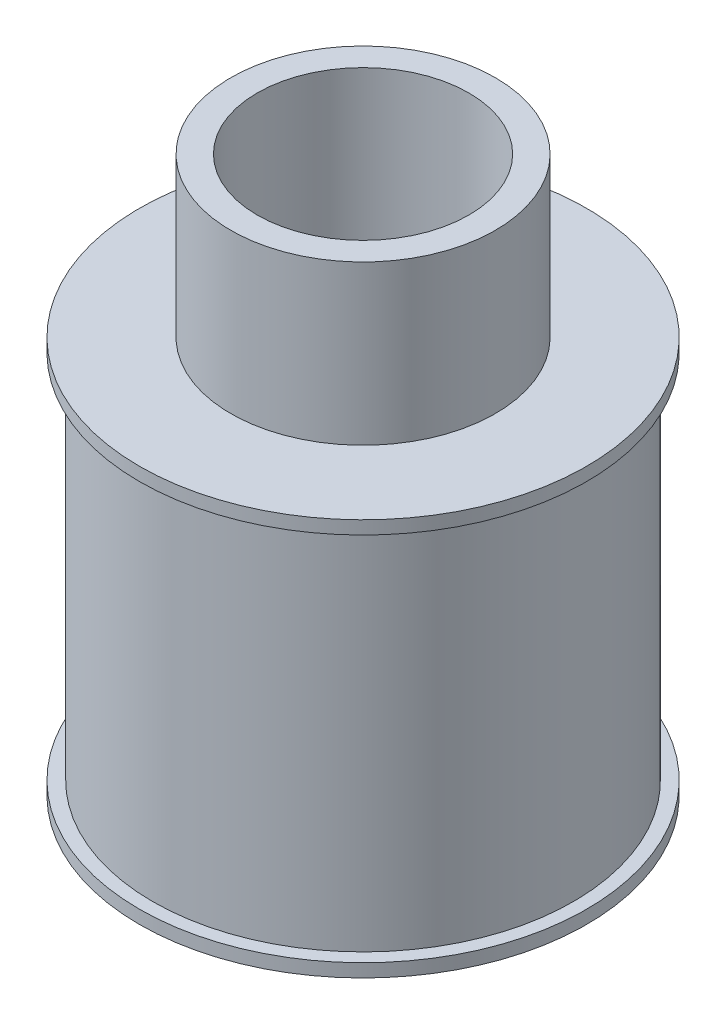
from build123d import *

# Parameters (mm, degrees)
CROQUIS1_R                 = 7.95
SALIENTE_EXTRUIR1_DEPTH    = 7.5
CROQUIS2_R                 = 8.45
SALIENTE_EXTRUIR2_DEPTH    = 0.5
SALIENTE_EXTRUIR3_START    = -14.5
CROQUIS2_2_R               = 8.45
SALIENTE_EXTRUIR3_DEPTH    = 0.5
CROQUIS3_R                 = 5
SALIENTE_EXTRUIR4_DEPTH    = 21
CORTAR_EXTRUIR1_DEPTH      = 24.728779994
CORTAR_EXTRUIR1_DEPTH_BACK = 24.728779994
CROQUIS4_R                 = 3
CROQUIS10_R                = 4
CORTAR_EXTRUIR2_DEPTH      = 25.162057032


with BuildPart() as part:
    # Croquis1 → Saliente-Extruir1 (new, symmetric)
    with BuildSketch(Plane(origin=(0, 0, 0), x_dir=(-1, 0, 0), z_dir=(0, 1, 0))):
        with Locations(Location((0, 0, 0), (0, 0, 90))):
            Circle(CROQUIS1_R)
    extrude(amount=SALIENTE_EXTRUIR1_DEPTH, both=True)

    # Croquis2 → Saliente-Extruir2 (add)
    with BuildSketch(Plane(origin=(0, 7.5, 0), x_dir=(-1, 0, 0), z_dir=(0, 1, 0))):
        with Locations(Location((0, 0, 0), (0, 0, 90))):
            Circle(CROQUIS2_R)
    extrude(amount=-SALIENTE_EXTRUIR2_DEPTH)

    # Croquis2<2> → Saliente-Extruir3 (add)
    with BuildSketch(Plane(origin=(0, 7.5, 0), x_dir=(-1, 0, 0), z_dir=(0, 1, 0)).offset(SALIENTE_EXTRUIR3_START)):
        with Locations(Location((0, 0, 0), (0, 0, 90))):
            Circle(CROQUIS2_2_R)
    extrude(amount=-SALIENTE_EXTRUIR3_DEPTH)

    # Croquis3 → Saliente-Extruir4 (add)
    with BuildSketch(Plane(origin=(0, -7.5, 0), x_dir=(-1, 0, 0), z_dir=(0, 1, 0))):
        with Locations(Location((0, 0, 0), (0, 0, 270))):
            Circle(CROQUIS3_R)
    extrude(amount=SALIENTE_EXTRUIR4_DEPTH)

    # Croquis4 → Cortar-Extruir1 (cut, two sides: drawn at the far end of the back side and taken through both)
    with BuildSketch(Plane(origin=(0, -7, 0), x_dir=(-1, 0, 0), z_dir=(0, 1, 0)).offset(-CORTAR_EXTRUIR1_DEPTH_BACK)):
        with Locations(Location((0, 0, 0), (0, 0, 90))):
            Circle(CROQUIS4_R)
    extrude(amount=CORTAR_EXTRUIR1_DEPTH + CORTAR_EXTRUIR1_DEPTH_BACK, mode=Mode.SUBTRACT)

    # Croquis10 → Cortar-Extruir2 (cut, through all)
    with BuildSketch(Plane.XZ.offset(7.5)):
        with Locations(Location((0, 0, 0), (0, 0, 270))):
            Circle(CROQUIS10_R)
    extrude(amount=-CORTAR_EXTRUIR2_DEPTH, mode=Mode.SUBTRACT)


solid = part.part
